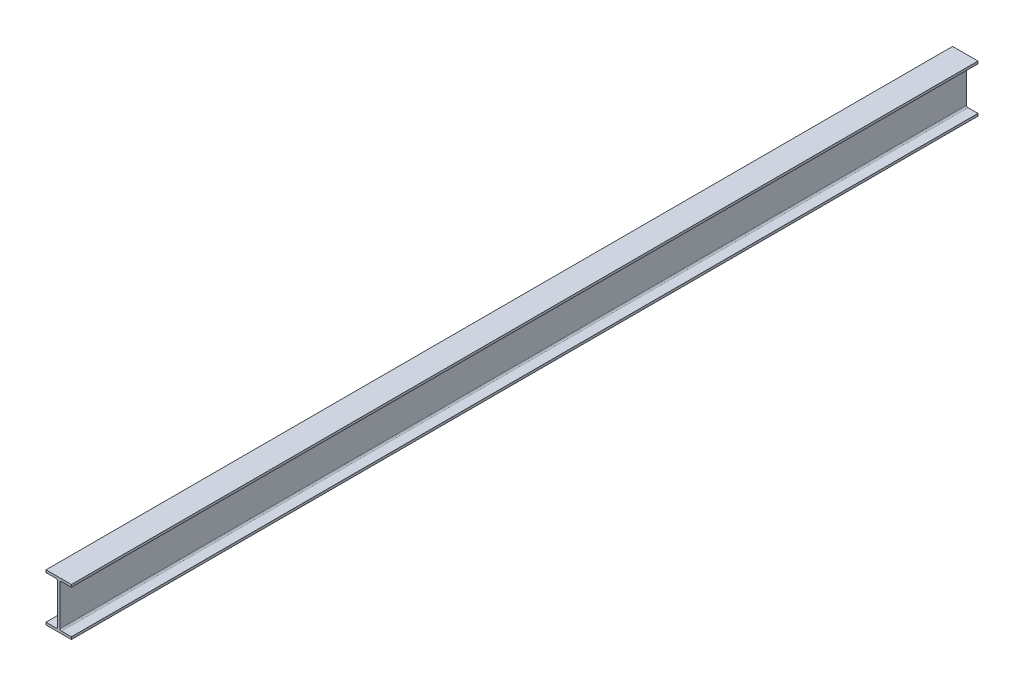
from build123d import *

# Parameters (mm, degrees)
BOSS_EXTRUDE1_DEPTH = 3000


with BuildPart() as part:
    # Sketch1 → Boss-Extrude1 (new body)
    with BuildSketch(Plane.XY):
        with BuildLine():
            Line((-4, -66), (-4, 66))
            ThreePointArc((-4, 66), (-5.464466094, 69.535533906), (-9, 71))
            Line((-9, 71), (-42, 71))
            Line((-42, 71), (-42, 79))
            Line((-42, 79), (42, 79))
            Line((42, 79), (42, 71))
            Line((42, 71), (9, 71))
            ThreePointArc((9, 71), (5.464466094, 69.535533906), (4, 66))
            Line((4, 66), (4, -66))
            ThreePointArc((4, -66), (5.464466094, -69.535533906), (9, -71))
            Line((9, -71), (42, -71))
            Line((42, -71), (42, -79))
            Line((42, -79), (-42, -79))
            Line((-42, -79), (-42, -71))
            Line((-42, -71), (-9, -71))
            ThreePointArc((-9, -71), (-5.464466094, -69.535533906), (-4, -66))
        make_face()
    extrude(amount=BOSS_EXTRUDE1_DEPTH)


solid = part.part
